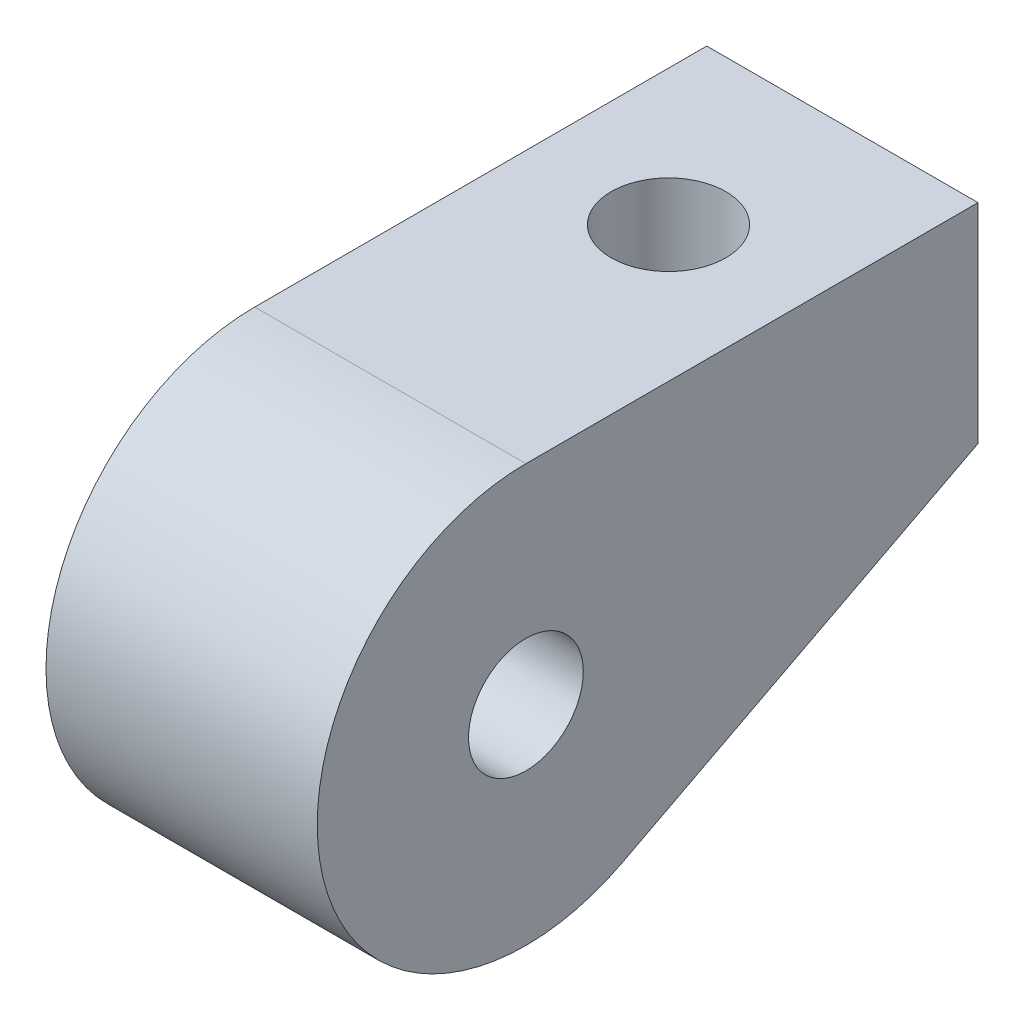
from build123d import *

# Parameters (mm, degrees)
SKETCH1_R           = 1.65
BOSS_EXTRUDE1_DEPTH = 3.9
BOSS_EXTRUDE2_DEPTH = 3.9
SKETCH2_R           = 1.65
CUT_EXTRUDE5_DEPTH  = 19.116567004
CUT_EXTRUDE6_START  = 4
CUT_EXTRUDE6_DEPTH  = 15.116567004


with BuildPart() as part:
    # Sketch1 → Boss-Extrude1 (new, symmetric)
    with BuildSketch(Plane(origin=(0, 0, 0), x_dir=(0, 0, -1), z_dir=(1, 0, 0))):
        with BuildLine():
            ThreePointArc((6, 0), (4.242640687, 4.242640687), (0, 6))
            ThreePointArc((0, 6), (-5.828221306, -1.425424992), (2.769230769, -5.322721198))
            ThreePointArc((2.769230769, -5.322721198), (5.129102486, -3.11324713), (6, 0))
        make_face()
        Circle(SKETCH1_R, mode=Mode.SUBTRACT)
    extrude(amount=BOSS_EXTRUDE1_DEPTH, both=True)

    # Sketch1<4> → Boss-Extrude2 (add, symmetric)
    with BuildSketch(Plane(origin=(0, 0, 0), x_dir=(0, 0, -1), z_dir=(1, 0, 0))):
        with BuildLine():
            Line((13, 6), (0, 6))
            ThreePointArc((0, 6), (4.242640687, 4.242640687), (6, 0))
            ThreePointArc((6, 0), (5.129102486, -3.11324713), (2.769230769, -5.322721198))
            Line((2.769230769, -5.322721198), (13, 0))
            Line((13, 0), (13, 6))
        make_face()
    extrude(amount=BOSS_EXTRUDE2_DEPTH, both=True)

    # Sketch2 → Cut-Extrude5 (cut, through all)
    with BuildSketch(Plane(origin=(0, 6, 0), x_dir=(1, 0, 0), z_dir=(0, 1, 0))):
        with Locations((0, 8)):
            Circle(SKETCH2_R)
    extrude(amount=-CUT_EXTRUDE5_DEPTH, mode=Mode.SUBTRACT)

    # Sketch3 → Cut-Extrude6 (cut, through all)
    with BuildSketch(Plane.XZ.offset(-6).offset(CUT_EXTRUDE6_START)):
        Polygon((0, -11.3), (2.857883832, -9.65), (2.857883832, -6.35), (0, -4.7), (-2.857883832, -6.35), (-2.857883832, -9.65), align=None)
    extrude(amount=CUT_EXTRUDE6_DEPTH, mode=Mode.SUBTRACT)


solid = part.part
